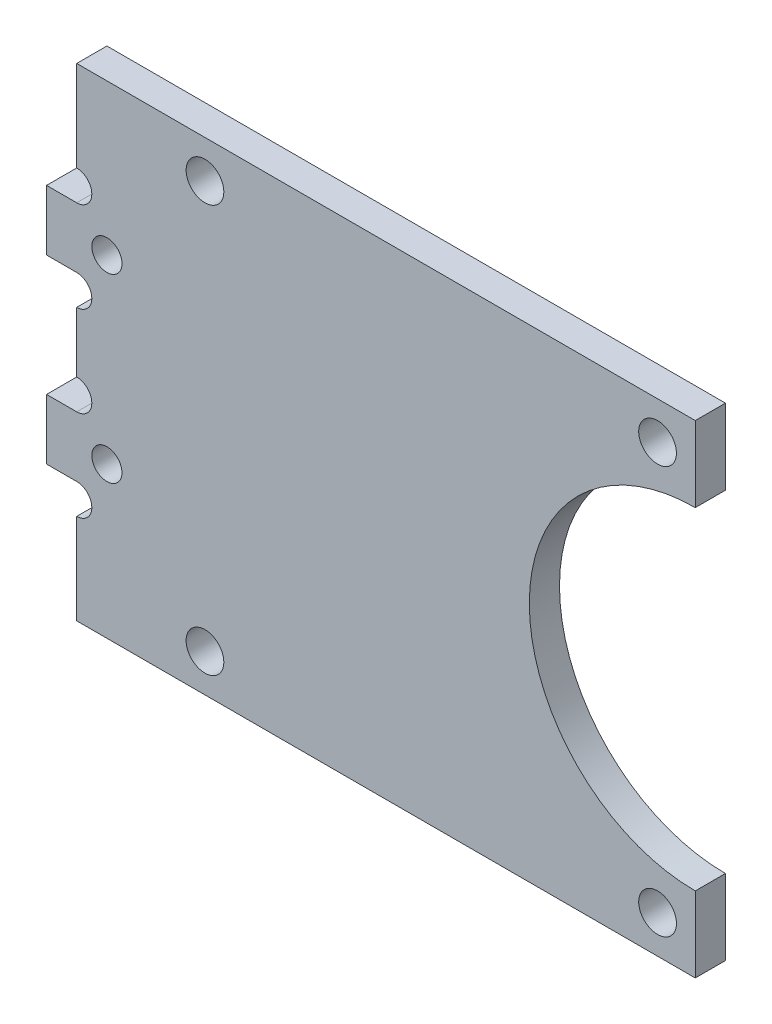
from build123d import *

# Parameters (mm, degrees)
SKETCH_1_R          = 1.25
SKETCH_1_R_2        = 1
EXTRUDE_1_DEPTH     = 2
CUT_EXTRUDE_4_DEPTH = 10


with BuildPart() as part:
    # 草圖1 → 填料-伸長1 (new body)
    with BuildSketch(Plane.XY):
        with BuildLine():
            Line((-17.216213198, 10.1625), (15.283786802, 10.1625))
            Line((15.283786802, 10.1625), (15.283786802, -21.8375))
            Line((15.283786802, -21.8375), (-17.216213198, -21.8375))
            Line((-17.216213198, -21.8375), (-19.716213198, -21.8375))
            Line((-19.716213198, -21.8375), (-25.716213198, -21.8375))
            Line((-25.716213198, -21.8375), (-25.716213198, -15.8375))
            ThreePointArc((-25.716213198, -15.8375), (-24.716213198, -14.8375), (-25.716213198, -13.8375))
            Line((-25.716213198, -13.8375), (-27.716213198, -13.8375))
            Line((-27.716213198, -13.8375), (-27.716213198, -9.8375))
            Line((-27.716213198, -9.8375), (-25.716213198, -9.8375))
            ThreePointArc((-25.716213198, -9.8375), (-24.716213198, -8.8375), (-25.716213198, -7.8375))
            Line((-25.716213198, -7.8375), (-25.716213198, -3.8375))
            ThreePointArc((-25.716213198, -3.8375), (-24.716213198, -2.8375), (-25.716213198, -1.8375))
            Line((-25.716213198, -1.8375), (-27.716213198, -1.8375))
            Line((-27.716213198, -1.8375), (-27.716213198, 2.1625))
            Line((-27.716213198, 2.1625), (-25.716213198, 2.1625))
            ThreePointArc((-25.716213198, 2.1625), (-24.716213198, 3.1625), (-25.716213198, 4.1625))
            Line((-25.716213198, 4.1625), (-25.716213198, 10.1625))
            Line((-25.716213198, 10.1625), (-19.716213198, 10.1625))
            Line((-19.716213198, 10.1625), (-17.216213198, 10.1625))
        make_face()
        with Locations((-17.216213198, 7.6625)):
            Circle(SKETCH_1_R, mode=Mode.SUBTRACT)
        with Locations((-17.216213198, -19.3375)):
            Circle(SKETCH_1_R, mode=Mode.SUBTRACT)
        with Locations((12.783786802, -19.3375)):
            Circle(SKETCH_1_R, mode=Mode.SUBTRACT)
        with Locations((12.783786802, 7.6625)):
            Circle(SKETCH_1_R, mode=Mode.SUBTRACT)
        with Locations((-23.716213198, 0.1625)):
            Circle(SKETCH_1_R_2, mode=Mode.SUBTRACT)
        with Locations((-23.716213198, -11.8375)):
            Circle(SKETCH_1_R_2, mode=Mode.SUBTRACT)
    extrude(amount=EXTRUDE_1_DEPTH)

    # 草圖4 → 除料-伸長4 (cut)
    with BuildSketch(Plane(origin=(0, 0, 0), x_dir=(-1, 0, 0), z_dir=(0, 0, -1))):
        with BuildLine():
            Line((-15.283786802, -16.8375), (-15.283786802, 5.1625))
            ThreePointArc((-15.283786802, 5.1625), (-4.283786802, -5.8375), (-15.283786802, -16.8375))
        make_face()
    extrude(amount=-CUT_EXTRUDE_4_DEPTH, mode=Mode.SUBTRACT)


solid = part.part
